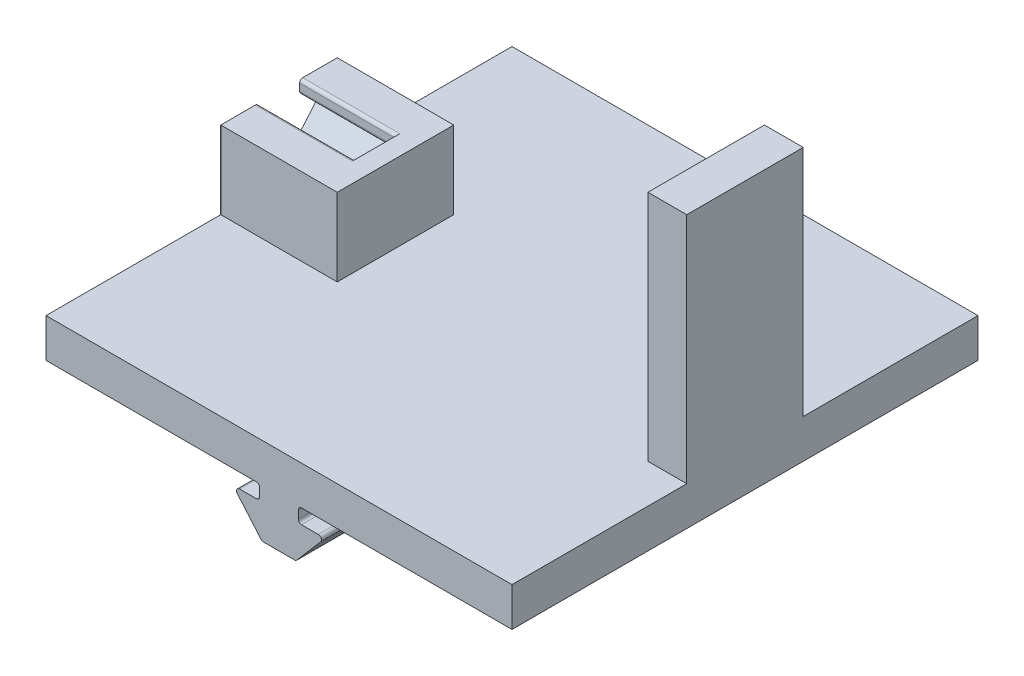
from build123d import *

# Parameters (mm, degrees)
SKETCH1_W                       = 76.2
SKETCH1_H                       = 6.35
BOSS_EXTRUDE1_DEPTH             = 38.1
SKETCH2_W                       = 19.05
SKETCH2_H                       = 12.7
SKETCH2_W_2                     = 6.35
SKETCH2_H_2                     = 38.1
BOSS_EXTRUDE2_DEPTH             = 9.525
BOSS_EXTRUDE3_REACH             = 71.85
BOSS_EXTRUDE3_DIRECTION_2_REACH = 71.85
CUT_EXTRUDE2_START              = 38.1
CUT_EXTRUDE2_DEPTH              = 15.875
FILLET1_R                       = 0.508


with BuildPart() as part:
    # Sketch1 → Boss-Extrude1 (new, symmetric)
    with BuildSketch(Plane.XY):
        with Locations((0, 3.175)):
            Rectangle(SKETCH1_W, SKETCH1_H)
    extrude(amount=BOSS_EXTRUDE1_DEPTH, both=True)

    # Sketch2 → Boss-Extrude2 (add, symmetric)
    with BuildSketch(Plane.XY):
        with Locations((-28.575, 12.7)):
            Rectangle(SKETCH2_W, SKETCH2_H)
        with Locations((34.925, 25.4)):
            Rectangle(SKETCH2_W_2, SKETCH2_H_2)
    extrude(amount=BOSS_EXTRUDE2_DEPTH, both=True)

    # Boss-Extrude3: up to this face of the body (flat: up to its plane)
    boss_extrude3_end = Plane(part.part.faces().sort_by_distance((0, 3.175, 38.1))[0])
    # Sketch3 → Boss-Extrude3 (add, up to the picked face)
    with BuildSketch(Plane.XY, mode=Mode.PRIVATE) as boss_extrude3_sk1:
        Polygon((-3.175, 0), (-3.175, -2.38125), (-7.540625, -2.38125), (-2.778125, -7.9375), (2.778125, -7.9375), (7.540625, -2.38125), (3.175, -2.38125), (3.175, 0), align=None)
    boss_extrude3_tool1 = split(extrude(boss_extrude3_sk1.sketch, amount=BOSS_EXTRUDE3_REACH, mode=Mode.PRIVATE), bisect_by=boss_extrude3_end, keep=Keep.BOTH, mode=Mode.PRIVATE)
    add(boss_extrude3_tool1.solids().sort_by(Axis((0, -3.992908, 0), (0, 0, 1)))[0])

    # Boss-Extrude3 direction 2: up to this face of the body (flat: up to its plane)
    boss_extrude3_direction_2_end = Plane(part.part.faces().sort_by_distance((0, 3.175, -38.1))[0])
    # Sketch3 → Boss-Extrude3 direction 2 (add, up to the picked face)
    with BuildSketch(Plane.XY, mode=Mode.PRIVATE) as boss_extrude3_direction_2_sk1:
        Polygon((-3.175, 0), (-3.175, -2.38125), (-7.540625, -2.38125), (-2.778125, -7.9375), (2.778125, -7.9375), (7.540625, -2.38125), (3.175, -2.38125), (3.175, 0), align=None)
    boss_extrude3_direction_2_tool1 = split(extrude(boss_extrude3_direction_2_sk1.sketch, amount=-BOSS_EXTRUDE3_DIRECTION_2_REACH, mode=Mode.PRIVATE), bisect_by=boss_extrude3_direction_2_end, keep=Keep.BOTH, mode=Mode.PRIVATE)
    add(boss_extrude3_direction_2_tool1.solids().sort_by(Axis((0, -3.992908, 0), (0, 0, -1)))[0])

    # Sketch5 → Cut-Extrude2 (cut)
    with BuildSketch(Plane.ZY.offset(CUT_EXTRUDE2_START)):
        Polygon((-3.375, 19.05), (-3.375, 16.86875), (-7.975469127, 16.86875), (-2.870111984, 10.9125), (2.870111984, 10.9125), (7.975469127, 16.86875), (3.375, 16.86875), (3.375, 19.05), align=None)
    extrude(amount=-CUT_EXTRUDE2_DEPTH, mode=Mode.SUBTRACT)

    # Fillet1
    fillet1_edges = [part.edges().sort_by_distance(p)[0] for p in [
        (3.175, 0, 0),
        (-3.175, 0, 0),
        (-3.175, -2.38125, 0),
        (-7.540625, -2.38125, 0),
        (-2.778125, -7.9375, 0),
        (2.778125, -7.9375, 0),
        (7.540625, -2.38125, 0),
        (3.175, -2.38125, 0),
        (-30.1625, 19.05, -3.375),
        (-30.1625, 19.05, 3.375),
        (-30.1625, 16.86875, 3.375),
        (-30.1625, 16.86875, 7.975469127),
        (-30.1625, 10.9125, 2.870111984),
        (-30.1625, 10.9125, -2.870111984),
        (-30.1625, 16.86875, -7.975469127),
        (-30.1625, 16.86875, -3.375),
    ]]
    fillet(fillet1_edges, radius=FILLET1_R)


solid = part.part
